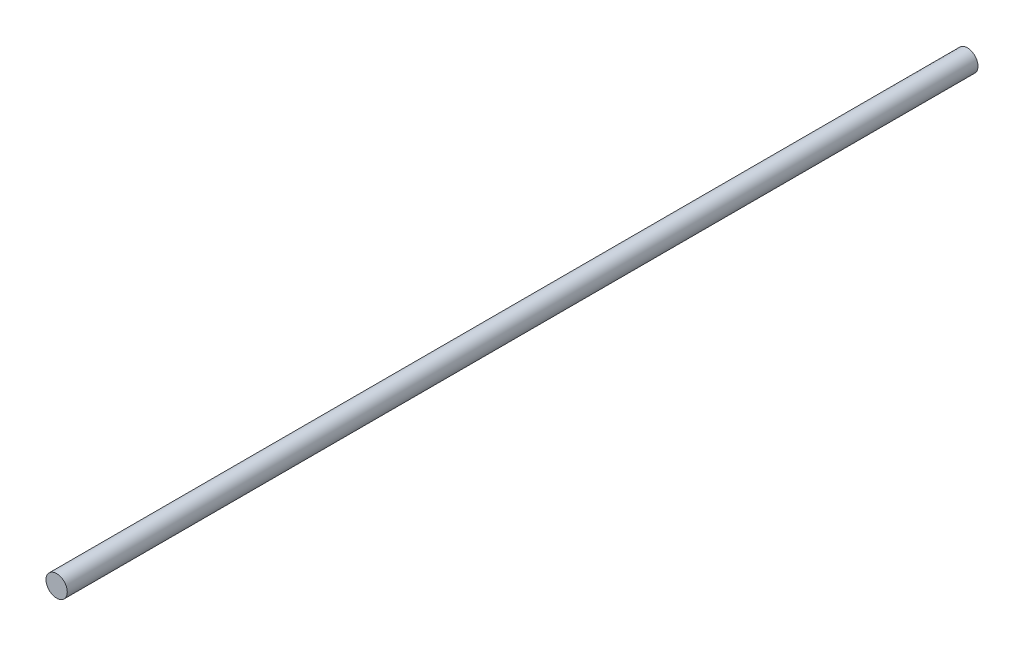
from build123d import *

# Parameters (mm, degrees)
SKETCH1_R           = 4
BOSS_EXTRUDE1_DEPTH = 342


with BuildPart() as part:
    # Sketch1 → Boss-Extrude1 (new body)
    with BuildSketch(Plane.XY):
        Circle(SKETCH1_R)
    extrude(amount=BOSS_EXTRUDE1_DEPTH)


solid = part.part
